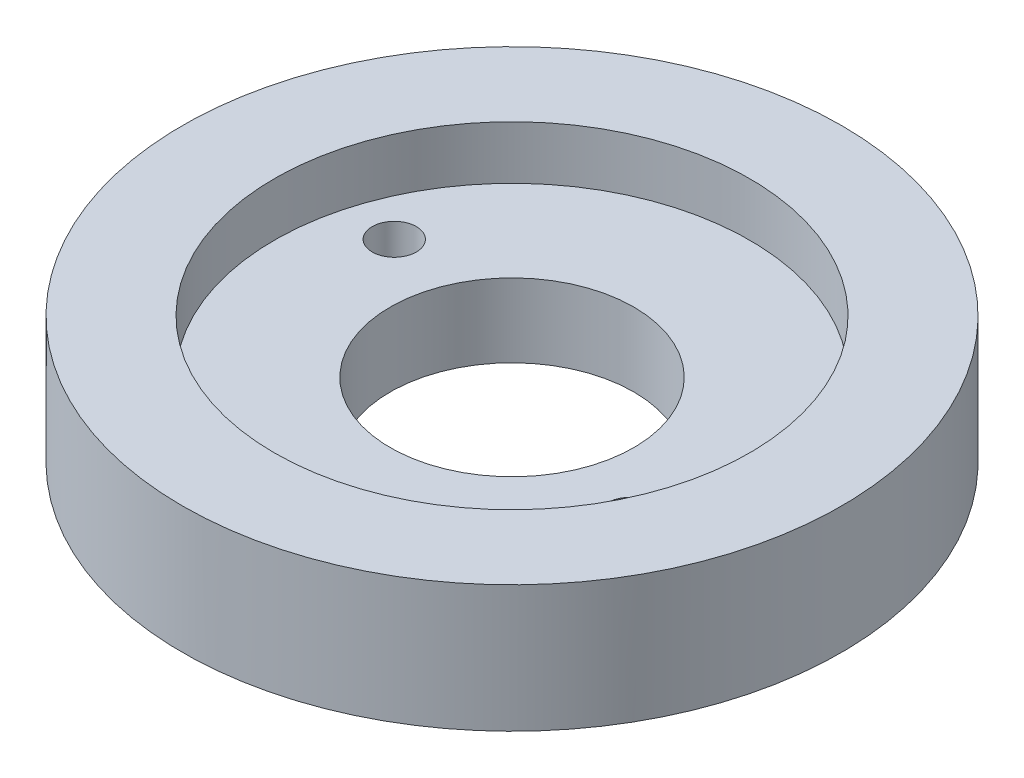
from build123d import *

# Parameters (mm, degrees)
SKETCH2_R           = 35.85
BOSS_EXTRUDE3_DEPTH = 11.802411407
SKETCH3_R           = 13.25
CUT_EXTRUDE1_DEPTH  = 6
SHELL1_T            = -10
CUT_EXTRUDE2_START  = -6
SKETCH4_R           = 23.25
CUT_EXTRUDE2_DEPTH  = 6
CUT_EXTRUDE3_START  = -4
SKETCH5_R           = 25.85
CUT_EXTRUDE3_DEPTH  = 4
SKETCH6_R           = 2.4
CUT_EXTRUDE4_DEPTH  = 18
BOSS_EXTRUDE4_START = 2
SKETCH7_R           = 35.85
BOSS_EXTRUDE4_DEPTH = 2
SKETCH8_R           = 5
SKETCH8_R_2         = 13.25
CUT_EXTRUDE6_DEPTH  = 2


with BuildPart() as part:
    # Sketch2 → Boss-Extrude3 (new body)
    with BuildSketch(Plane(origin=(0, 0, 0), x_dir=(1, 0, 0), z_dir=(0, 1, 0))):
        with Locations(Location((0, 0, 0), (0, 0, 270))):
            Circle(SKETCH2_R)
    extrude(amount=BOSS_EXTRUDE3_DEPTH)

    # Sketch3 → Cut-Extrude1 (cut)
    with BuildSketch(Plane.XZ):
        with Locations(Location((0, 0, 0), (0, 0, 270))):
            Circle(SKETCH3_R)
    extrude(amount=-CUT_EXTRUDE1_DEPTH, mode=Mode.SUBTRACT)

    # Shell1
    shell1_openings = [part.faces().sort_by_distance(p)[0] for p in [
        (0, 11.802411407, 0),
    ]]
    offset(amount=SHELL1_T, openings=shell1_openings, kind=Kind.INTERSECTION)

    # Sketch4 → Cut-Extrude2 (cut)
    with BuildSketch(Plane(origin=(0, 16, 0), x_dir=(1, 0, 0), z_dir=(0, 1, 0)).offset(CUT_EXTRUDE2_START)):
        Circle(SKETCH4_R)
    extrude(amount=CUT_EXTRUDE2_DEPTH, mode=Mode.SUBTRACT)

    # Sketch5 → Cut-Extrude3 (cut)
    with BuildSketch(Plane(origin=(0, 10, 0), x_dir=(1, 0, 0), z_dir=(0, 1, 0)).offset(CUT_EXTRUDE3_START)):
        with Locations(Location((0, 0, 0), (0, 0, 270))):
            Circle(SKETCH5_R)
    extrude(amount=CUT_EXTRUDE3_DEPTH, mode=Mode.SUBTRACT)

    # Sketch6 → Cut-Extrude4 (cut)
    with BuildSketch(Plane.XZ):
        with Locations(Location((-19.408408583, -6.6002785, 0), (0, 0, 270))):
            Circle(SKETCH6_R)
        with Locations(Location((19.408408583, 6.6002785, 0), (0, 0, 270))):
            Circle(SKETCH6_R)
    extrude(amount=-CUT_EXTRUDE4_DEPTH, mode=Mode.SUBTRACT)

    # Sketch7 → Boss-Extrude4 (add)
    with BuildSketch(Plane.XZ.offset(BOSS_EXTRUDE4_START)):
        with Locations(Location((0, 0, 0), (0, 0, 270))):
            Circle(SKETCH7_R)
    extrude(amount=-BOSS_EXTRUDE4_DEPTH)

    # Sketch8 → Cut-Extrude6 (cut)
    with BuildSketch(Plane.XZ.offset(2)):
        with Locations(Location((-19.408408583, -6.6002785, 0), (0, 0, 270))):
            Circle(SKETCH8_R)
        with Locations(Location((19.408408583, 6.6002785, 0), (0, 0, 270))):
            Circle(SKETCH8_R)
        with Locations(Location((0, 0, 0), (0, 0, 270))):
            Circle(SKETCH8_R_2)
    extrude(amount=-CUT_EXTRUDE6_DEPTH, mode=Mode.SUBTRACT)


solid = part.part
